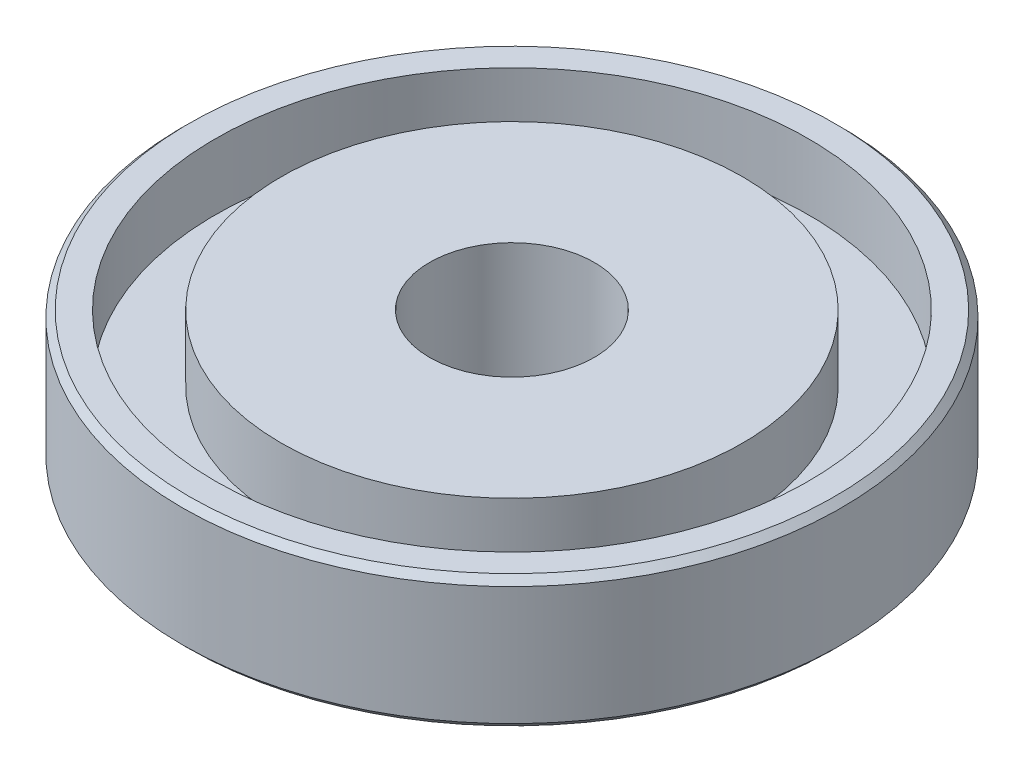
from build123d import *

# Parameters (mm, degrees)
SKETCH_1_R          = 50
EXTRUDE_1_DEPTH     = 20
SKETCH_2_R          = 45
SKETCH_2_R_2        = 35
CUT_EXTRUDE_1_DEPTH = 10
SKETCH_3_R          = 12.5
CUT_EXTRUDE_2_DEPTH = 74.484692283
CHAMFER_1_SIZE      = 1


with BuildPart() as part:
    # 草图1 → 凸台-拉伸1 (new body)
    with BuildSketch(Plane(origin=(0, 0, 0), x_dir=(1, 0, 0), z_dir=(0, 1, 0))):
        with Locations(Location((0, 0, 0), (0, 0, 270))):
            Circle(SKETCH_1_R)
    extrude(amount=EXTRUDE_1_DEPTH)

    # 草图2 → 切除-拉伸1 (cut)
    with BuildSketch(Plane(origin=(0, 20, 0), x_dir=(1, 0, 0), z_dir=(0, 1, 0))):
        with Locations(Location((0, 0, 0), (0, 0, 270))):
            Circle(SKETCH_2_R)
        with Locations(Location((0, 0, 0), (0, 0, 270))):
            Circle(SKETCH_2_R_2, mode=Mode.SUBTRACT)
    extrude(amount=-CUT_EXTRUDE_1_DEPTH, mode=Mode.SUBTRACT)

    # 草图3 → 切除-拉伸2 (cut, through all)
    with BuildSketch(Plane(origin=(0, 0, 0), x_dir=(1, 0, 0), z_dir=(0, 1, 0))):
        with Locations(Location((0, 0, 0), (0, 0, 270))):
            Circle(SKETCH_3_R)
    extrude(amount=CUT_EXTRUDE_2_DEPTH, mode=Mode.SUBTRACT)

    # 倒角1
    chamfer_1_edges = [part.edges().sort_by_distance(p)[0] for p in [
        (0, 0, -50),
        (0, 20, -50),
    ]]
    chamfer(chamfer_1_edges, length=CHAMFER_1_SIZE)


solid = part.part
